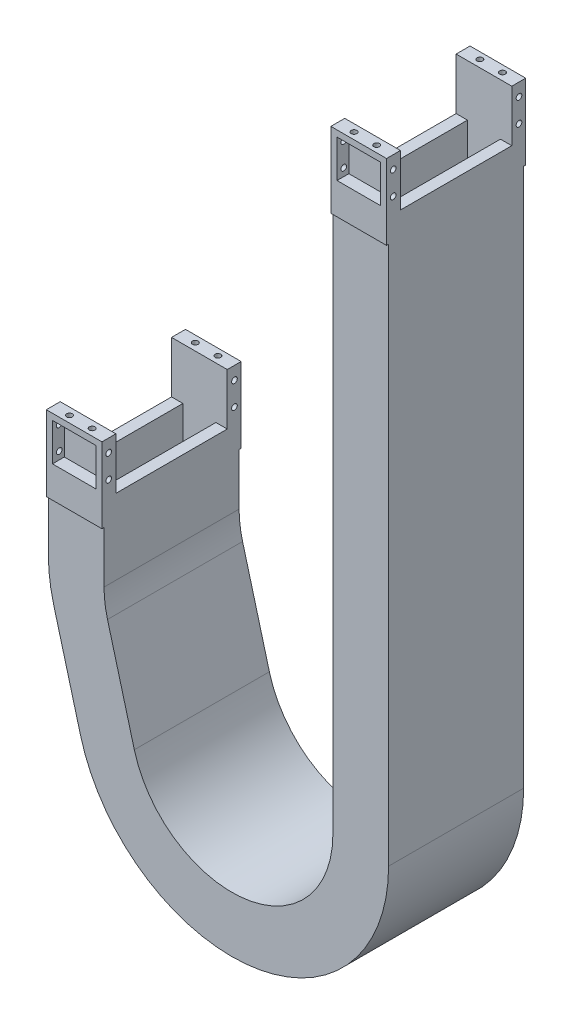
from build123d import *

# Parameters (mm, degrees)
SKETCH2_W           = 54
SKETCH2_H           = 131
SKETCH2_W_2         = 32
SKETCH2_H_2         = 108
SKETCH12_W          = 54
SKETCH12_H          = 131
SKETCH12_W_2        = 32
SKETCH12_H_2        = 108
BOSS_EXTRUDE1_DEPTH = 1
SKETCH3_W           = 54
SKETCH3_H           = 135
SKETCH3_W_2         = 32
SKETCH3_H_2         = 108
EXTRUDE1_DEPTH      = 73
EXTRUDE2_REACH      = 763.64
SKETCH4_R           = 2.75
SKETCH4_W           = 108
SKETCH4_H           = 50
SKETCH7_W           = 54
SKETCH7_H           = 135
SKETCH7_W_2         = 32
SKETCH7_H_2         = 108
EXTRUDE5_DEPTH      = 73
EXTRUDE6_REACH      = 741.845
SKETCH8_R           = 2.75
SKETCH8_W           = 108
SKETCH8_H           = 50
SKETCH5_W           = 42
SKETCH5_H           = 36.5
EXTRUDE3_DEPTH      = 11.5
SKETCH6_W           = 42
SKETCH6_H           = 36.5
EXTRUDE4_DEPTH      = 11.5
SKETCH9_R           = 2.75
EXTRUDE7_DEPTH      = 7
SKETCH10_R          = 2.75
EXTRUDE8_DEPTH      = 7


with BuildPart() as part:
    # Sweep1: sweep along a path in Sketch1
    with BuildLine(Plane.XY) as sweep1_path:
        Line((-276, -375), (-276, -425))
        ThreePointArc((-276, -425), (-274.917785393, -441.412874927), (-271.689880586, -457.541553807))
        Line((-271.689880586, -457.541553807), (-245.689880586, -553.970166708))
        ThreePointArc((-245.689880586, -553.970166708), (-108.587125073, -645.346398294), (0, -521.428612901))
        Line((0, -521.428612901), (0, 0))
    # Sketch2 → Sweep1 (sweep)
    with BuildSketch(Plane(origin=(0, 0, 0), x_dir=(1, 0, 0), z_dir=(0, 1, 0))):
        with Locations((0, -65.5)):
            Rectangle(SKETCH2_W, SKETCH2_H)
        with Locations((0, -65.5)):
            Rectangle(SKETCH2_W_2, SKETCH2_H_2, mode=Mode.SUBTRACT)
    sweep(path=sweep1_path.line)

    # Sketch12 → Boss-Extrude1 (add)
    with BuildSketch(Plane(origin=(0, 0, 0), x_dir=(1, 0, 0), z_dir=(0, 1, 0))):
        with Locations((0, -65.5)):
            Rectangle(SKETCH12_W, SKETCH12_H)
        with Locations((0, -65.5)):
            Rectangle(SKETCH12_W_2, SKETCH12_H_2, mode=Mode.SUBTRACT)
    extrude(amount=BOSS_EXTRUDE1_DEPTH)

    # Sketch3 → Extrude1 (add)
    with BuildSketch(Plane(origin=(0, 1, 0), x_dir=(1, 0, 0), z_dir=(0, 1, 0))):
        with Locations((0, -65.5)):
            Rectangle(SKETCH3_W, SKETCH3_H)
        with Locations((0, -65.5)):
            Rectangle(SKETCH3_W_2, SKETCH3_H_2, mode=Mode.SUBTRACT)
    extrude(amount=EXTRUDE1_DEPTH)

    # Extrude2: up to this face of the body (flat: up to its plane)
    extrude2_end = Plane(part.part.faces().sort_by_distance((-27, -222.740088666, 65.5))[0])
    # Sketch4 → Extrude2 (cut, up to the picked face)
    with BuildSketch(Plane(origin=(27, 0, 0), x_dir=(0, 0, -1), z_dir=(1, 0, 0)), mode=Mode.PRIVATE) as extrude2_sk1:
        with Locations((-126.5, 61.5)):
            Circle(SKETCH4_R)
    extrude2_tool1 = split(extrude(extrude2_sk1.sketch, amount=-EXTRUDE2_REACH, mode=Mode.PRIVATE), bisect_by=extrude2_end, keep=Keep.BOTH, mode=Mode.PRIVATE)
    # Sketch4 → Extrude2 (cut, up to the picked face)
    with BuildSketch(Plane(origin=(27, 0, 0), x_dir=(0, 0, -1), z_dir=(1, 0, 0)), mode=Mode.PRIVATE) as extrude2_sk2:
        with Locations((-126.5, 39)):
            Circle(SKETCH4_R)
    extrude2_tool2 = split(extrude(extrude2_sk2.sketch, amount=-EXTRUDE2_REACH, mode=Mode.PRIVATE), bisect_by=extrude2_end, keep=Keep.BOTH, mode=Mode.PRIVATE)
    # Sketch4 → Extrude2 (cut, up to the picked face)
    with BuildSketch(Plane(origin=(27, 0, 0), x_dir=(0, 0, -1), z_dir=(1, 0, 0)), mode=Mode.PRIVATE) as extrude2_sk3:
        with Locations((-4.5, 39)):
            Circle(SKETCH4_R)
    extrude2_tool3 = split(extrude(extrude2_sk3.sketch, amount=-EXTRUDE2_REACH, mode=Mode.PRIVATE), bisect_by=extrude2_end, keep=Keep.BOTH, mode=Mode.PRIVATE)
    # Sketch4 → Extrude2 (cut, up to the picked face)
    with BuildSketch(Plane(origin=(27, 0, 0), x_dir=(0, 0, -1), z_dir=(1, 0, 0)), mode=Mode.PRIVATE) as extrude2_sk4:
        with Locations((-4.5, 61.5)):
            Circle(SKETCH4_R)
    extrude2_tool4 = split(extrude(extrude2_sk4.sketch, amount=-EXTRUDE2_REACH, mode=Mode.PRIVATE), bisect_by=extrude2_end, keep=Keep.BOTH, mode=Mode.PRIVATE)
    # Sketch4 → Extrude2 (cut, up to the picked face)
    with BuildSketch(Plane(origin=(27, 0, 0), x_dir=(0, 0, -1), z_dir=(1, 0, 0)), mode=Mode.PRIVATE) as extrude2_sk5:
        with Locations((-65.5, 49)):
            Rectangle(SKETCH4_W, SKETCH4_H)
    extrude2_tool5 = split(extrude(extrude2_sk5.sketch, amount=-EXTRUDE2_REACH, mode=Mode.PRIVATE), bisect_by=extrude2_end, keep=Keep.BOTH, mode=Mode.PRIVATE)
    add(extrude2_tool1.solids().sort_by(Axis((27, 61.5, 126.5), (-1, 0, 0)))[0], mode=Mode.SUBTRACT)
    add(extrude2_tool2.solids().sort_by(Axis((27, 39, 126.5), (-1, 0, 0)))[0], mode=Mode.SUBTRACT)
    add(extrude2_tool3.solids().sort_by(Axis((27, 39, 4.5), (-1, 0, 0)))[0], mode=Mode.SUBTRACT)
    add(extrude2_tool4.solids().sort_by(Axis((27, 61.5, 4.5), (-1, 0, 0)))[0], mode=Mode.SUBTRACT)
    add(extrude2_tool5.solids().sort_by(Axis((27, 49, 65.5), (-1, 0, 0)))[0], mode=Mode.SUBTRACT)

    # Sketch7 → Extrude5 (add)
    with BuildSketch(Plane(origin=(0, -375, 0), x_dir=(1, 0, 0), z_dir=(0, 1, 0))):
        with Locations((-276, -65.5)):
            Rectangle(SKETCH7_W, SKETCH7_H)
        with Locations((-276, -65.5)):
            Rectangle(SKETCH7_W_2, SKETCH7_H_2, mode=Mode.SUBTRACT)
    extrude(amount=EXTRUDE5_DEPTH)

    # Extrude6: up to this face of the body (flat: up to its plane)
    extrude6_end = Plane(part.part.faces().sort_by_distance((-303, -363.055013715, 65.5))[0])
    # Sketch8 → Extrude6 (cut, up to the picked face)
    with BuildSketch(Plane(origin=(-249, 0, 0), x_dir=(0, 0, -1), z_dir=(1, 0, 0)), mode=Mode.PRIVATE) as extrude6_sk1:
        with Locations((-4.5, -337)):
            Circle(SKETCH8_R)
    extrude6_tool1 = split(extrude(extrude6_sk1.sketch, amount=-EXTRUDE6_REACH, mode=Mode.PRIVATE), bisect_by=extrude6_end, keep=Keep.BOTH, mode=Mode.PRIVATE)
    # Sketch8 → Extrude6 (cut, up to the picked face)
    with BuildSketch(Plane(origin=(-249, 0, 0), x_dir=(0, 0, -1), z_dir=(1, 0, 0)), mode=Mode.PRIVATE) as extrude6_sk2:
        with Locations((-4.5, -314.5)):
            Circle(SKETCH8_R)
    extrude6_tool2 = split(extrude(extrude6_sk2.sketch, amount=-EXTRUDE6_REACH, mode=Mode.PRIVATE), bisect_by=extrude6_end, keep=Keep.BOTH, mode=Mode.PRIVATE)
    # Sketch8 → Extrude6 (cut, up to the picked face)
    with BuildSketch(Plane(origin=(-249, 0, 0), x_dir=(0, 0, -1), z_dir=(1, 0, 0)), mode=Mode.PRIVATE) as extrude6_sk3:
        with Locations((-126.5, -337)):
            Circle(SKETCH8_R)
    extrude6_tool3 = split(extrude(extrude6_sk3.sketch, amount=-EXTRUDE6_REACH, mode=Mode.PRIVATE), bisect_by=extrude6_end, keep=Keep.BOTH, mode=Mode.PRIVATE)
    # Sketch8 → Extrude6 (cut, up to the picked face)
    with BuildSketch(Plane(origin=(-249, 0, 0), x_dir=(0, 0, -1), z_dir=(1, 0, 0)), mode=Mode.PRIVATE) as extrude6_sk4:
        with Locations((-126.5, -314.5)):
            Circle(SKETCH8_R)
    extrude6_tool4 = split(extrude(extrude6_sk4.sketch, amount=-EXTRUDE6_REACH, mode=Mode.PRIVATE), bisect_by=extrude6_end, keep=Keep.BOTH, mode=Mode.PRIVATE)
    # Sketch8 → Extrude6 (cut, up to the picked face)
    with BuildSketch(Plane(origin=(-249, 0, 0), x_dir=(0, 0, -1), z_dir=(1, 0, 0)), mode=Mode.PRIVATE) as extrude6_sk5:
        with Locations((-65.5, -327)):
            Rectangle(SKETCH8_W, SKETCH8_H)
    extrude6_tool5 = split(extrude(extrude6_sk5.sketch, amount=-EXTRUDE6_REACH, mode=Mode.PRIVATE), bisect_by=extrude6_end, keep=Keep.BOTH, mode=Mode.PRIVATE)
    add(extrude6_tool1.solids().sort_by(Axis((-249, -337, 4.5), (-1, 0, 0)))[0], mode=Mode.SUBTRACT)
    add(extrude6_tool2.solids().sort_by(Axis((-249, -314.5, 4.5), (-1, 0, 0)))[0], mode=Mode.SUBTRACT)
    add(extrude6_tool3.solids().sort_by(Axis((-249, -337, 126.5), (-1, 0, 0)))[0], mode=Mode.SUBTRACT)
    add(extrude6_tool4.solids().sort_by(Axis((-249, -314.5, 126.5), (-1, 0, 0)))[0], mode=Mode.SUBTRACT)
    add(extrude6_tool5.solids().sort_by(Axis((-249, -327, 65.5), (-1, 0, 0)))[0], mode=Mode.SUBTRACT)

    # Sketch5 → Extrude3 (cut)
    with BuildSketch(Plane.XY.offset(133)):
        with Locations((0, 49.75)):
            Rectangle(SKETCH5_W, SKETCH5_H)
        with Locations((-276, -326.25)):
            Rectangle(SKETCH5_W, SKETCH5_H)
    extrude(amount=-EXTRUDE3_DEPTH, mode=Mode.SUBTRACT)

    # Sketch6 → Extrude4 (cut)
    with BuildSketch(Plane(origin=(0, 0, -2), x_dir=(-1, 0, 0), z_dir=(0, 0, -1))):
        with Locations((0, 49.75)):
            Rectangle(SKETCH6_W, SKETCH6_H)
        with Locations((276, -326.25)):
            Rectangle(SKETCH6_W, SKETCH6_H)
    extrude(amount=-EXTRUDE4_DEPTH, mode=Mode.SUBTRACT)

    # Sketch9 → Extrude7 (cut)
    with BuildSketch(Plane(origin=(0, 74, 0), x_dir=(1, 0, 0), z_dir=(0, 1, 0))):
        with Locations(Location((-11, -126.5, 0), (0, 0, 180))):
            Circle(SKETCH9_R)
        with Locations(Location((11, -126.5, 0), (0, 0, 180))):
            Circle(SKETCH9_R)
        with Locations(Location((11, -4.5, 0), (0, 0, 180))):
            Circle(SKETCH9_R)
        with Locations(Location((-11, -4.5, 0), (0, 0, 180))):
            Circle(SKETCH9_R)
    extrude(amount=-EXTRUDE7_DEPTH, mode=Mode.SUBTRACT)

    # Sketch10 → Extrude8 (cut)
    with BuildSketch(Plane(origin=(0, -302, 0), x_dir=(1, 0, 0), z_dir=(0, 1, 0))):
        with Locations(Location((-287, -126.5, 0), (0, 0, 270))):
            Circle(SKETCH10_R)
        with Locations(Location((-265, -126.5, 0), (0, 0, 270))):
            Circle(SKETCH10_R)
        with Locations(Location((-287, -4.5, 0), (0, 0, 270))):
            Circle(SKETCH10_R)
        with Locations(Location((-265, -4.5, 0), (0, 0, 270))):
            Circle(SKETCH10_R)
    extrude(amount=-EXTRUDE8_DEPTH, mode=Mode.SUBTRACT)


solid = part.part
